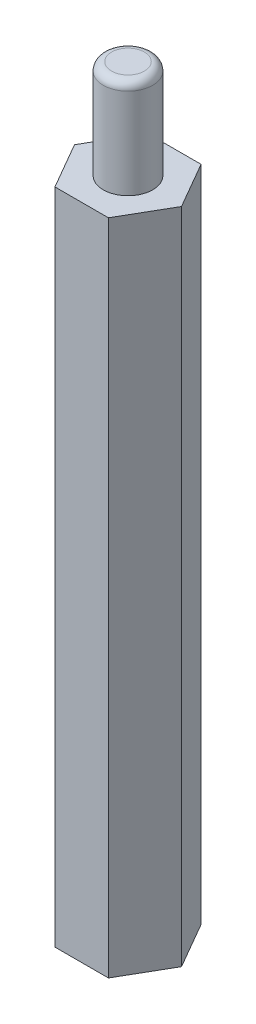
from build123d import *

# Parameters (mm, degrees)
SKETCH_1_R          = 1.5
EXTRUDE_1_DEPTH     = 46
FILLET_1_R          = 0.5
SKETCH_2_R          = 1.5
EXTRUDE_2_DEPTH     = 40
SKETCH_1_2_R        = 1.5
CUT_EXTRUDE_1_DEPTH = 10


with BuildPart() as part:
    # 草图1 → 凸台-拉伸1 (new body)
    with BuildSketch(Plane(origin=(0, 0, 0), x_dir=(1, 0, 0), z_dir=(0, 1, 0))):
        with Locations(Location((0, 0, 0), (0, 0, 270))):
            Circle(SKETCH_1_R)
    extrude(amount=EXTRUDE_1_DEPTH)

    # 圆角1
    fillet_1_edges = [part.edges().sort_by_distance(p)[0] for p in [
        (0, 46, -1.5),
    ]]
    fillet(fillet_1_edges, radius=FILLET_1_R)

    # 草图2 → 凸台-拉伸2 (add)
    with BuildSketch(Plane(origin=(0, 0, 0), x_dir=(1, 0, 0), z_dir=(0, 1, 0))):
        Polygon((-1.625, 2.814582562), (-3.25, 0), (-1.625, -2.814582562), (1.625, -2.814582562), (3.25, 0), (1.625, 2.814582562), align=None)
        with Locations(Location((0, 0, 0), (0, 0, 270))):
            Circle(SKETCH_2_R, mode=Mode.SUBTRACT)
    extrude(amount=EXTRUDE_2_DEPTH)

    # 草图1<2> → 切除-拉伸1 (cut)
    with BuildSketch(Plane(origin=(0, 0, 0), x_dir=(1, 0, 0), z_dir=(0, 1, 0))):
        with Locations(Location((0, 0, 0), (0, 0, 270))):
            Circle(SKETCH_1_2_R)
    extrude(amount=CUT_EXTRUDE_1_DEPTH, mode=Mode.SUBTRACT)


solid = part.part
